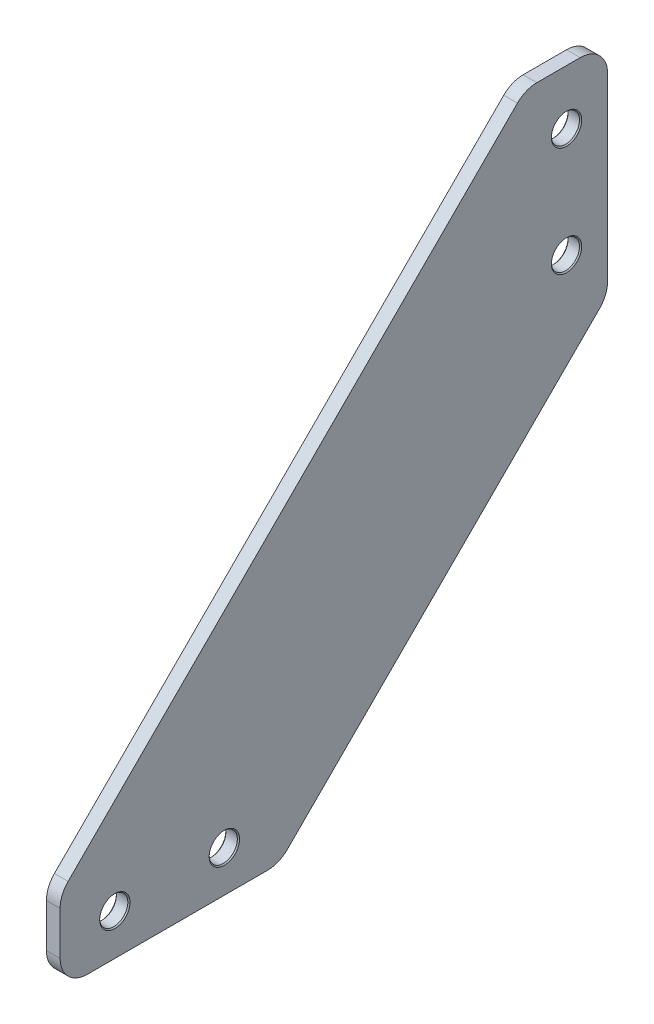
from build123d import *

# Parameters (mm, degrees)
BOSS_EXTRUDE1_DEPTH     = 1.5875
F_1_4_CLEARANCE_HOLE1_D = 6.5278
FILLET1_R               = 6.35
CHAMFER1_SIZE           = 0.254


with BuildPart() as part:
    # Sketch1 → Boss-Extrude1 (new, symmetric)
    with BuildSketch(Plane(origin=(0, 0, 0), x_dir=(0, 0, -1), z_dir=(1, 0, 0))):
        Polygon((0, 127), (-19.05, 127), (-127, 19.05), (-127, 0), (-76.2, 0), (0, 76.2), align=None)
    extrude(amount=BOSS_EXTRUDE1_DEPTH, both=True)

    # 1/4 Clearance Hole1 (through all)
    with Locations(Plane(origin=(1.5875, 0, 0), x_dir=(0, 0, -1), z_dir=(1, 0, 0))):
        with Locations((-114.3, 9.525), (-88.9, 9.525), (-9.525, 88.9), (-9.525, 114.3)):
            Hole(F_1_4_CLEARANCE_HOLE1_D / 2)

    # Fillet1
    fillet1_edges = [part.edges().sort_by_distance(p)[0] for p in [
        (0, 76.2, 0),
        (0, 127, 0),
        (0, 127, 19.05),
        (0, 19.05, 127),
        (0, 0, 76.2),
        (0, 0, 127),
    ]]
    fillet(fillet1_edges, radius=FILLET1_R)

    # Chamfer1
    chamfer1_edges = [part.edges().sort_by_distance(p)[0] for p in [
        (1.5875, 114.3, 6.2611),
        (-1.5875, 114.3, 6.2611),
        (1.5875, 88.9, 6.2611),
        (-1.5875, 88.9, 6.2611),
        (1.5875, 9.525, 111.0361),
        (-1.5875, 9.525, 111.0361),
        (1.5875, 9.525, 85.6361),
        (-1.5875, 9.525, 85.6361),
    ]]
    chamfer(chamfer1_edges, length=CHAMFER1_SIZE)


solid = part.part
